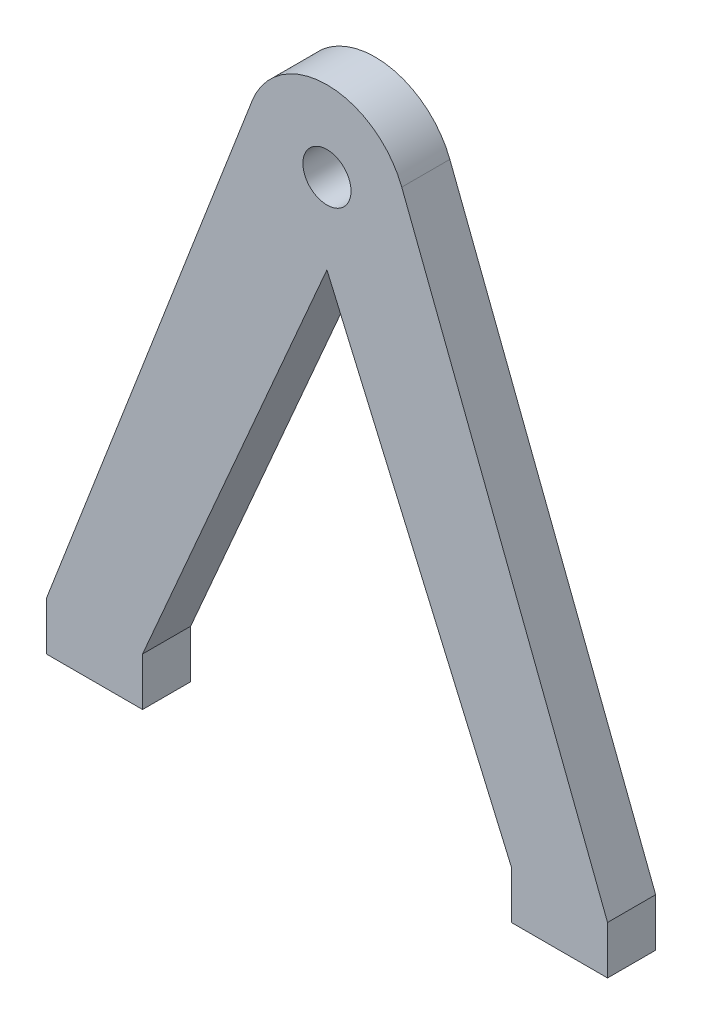
from build123d import *

# Parameters (mm, degrees)
ESBO_O1_R                = 5
ESBO_O1_W                = 12
ESBO_O1_H                = 6
RESSALTO_EXTRUS_O1_DEPTH = 6
RESSALTO_EXTRUS_O2_START = -6
ESBO_O2_R                = 5
ESBO_O2_R_2              = 3
RESSALTO_EXTRUS_O2_DEPTH = 6


with BuildPart() as part:
    # Esboço1 → Ressalto-extrusão1 (new body)
    # profile 1 of 3: a face of its own
    with BuildSketch(Plane.XY):
        with BuildLine():
            ThreePointArc((25.669132457, 72.596513714), (35, 79), (44.330867543, 72.596513714))
            Line((44.330867543, 72.596513714), (70, 6))
            Line((70, 6), (58, 6))
            Line((58, 6), (35, 59))
            Line((35, 59), (12, 6))
            Line((12, 6), (0, 6))
            Line((0, 6), (25.669132457, 72.596513714))
        make_face()
        with Locations((35, 69)):
            Circle(ESBO_O1_R, mode=Mode.SUBTRACT)
    # profile 2 of 3: a face of its own
    with BuildSketch(Plane.XY):
        with Locations((6, 3)):
            Rectangle(ESBO_O1_W, ESBO_O1_H)
    # profile 3 of 3: a face of its own
    with BuildSketch(Plane.XY):
        with Locations((64, 3)):
            Rectangle(ESBO_O1_W, ESBO_O1_H)
    extrude(amount=RESSALTO_EXTRUS_O1_DEPTH)

    # Esboço2 → Ressalto-extrusão2 (add)
    with BuildSketch(Plane.XY.offset(6).offset(RESSALTO_EXTRUS_O2_START)):
        with Locations((35, 69)):
            Circle(ESBO_O2_R)
        with Locations((35, 69)):
            Circle(ESBO_O2_R_2, mode=Mode.SUBTRACT)
    extrude(amount=RESSALTO_EXTRUS_O2_DEPTH)


solid = part.part
